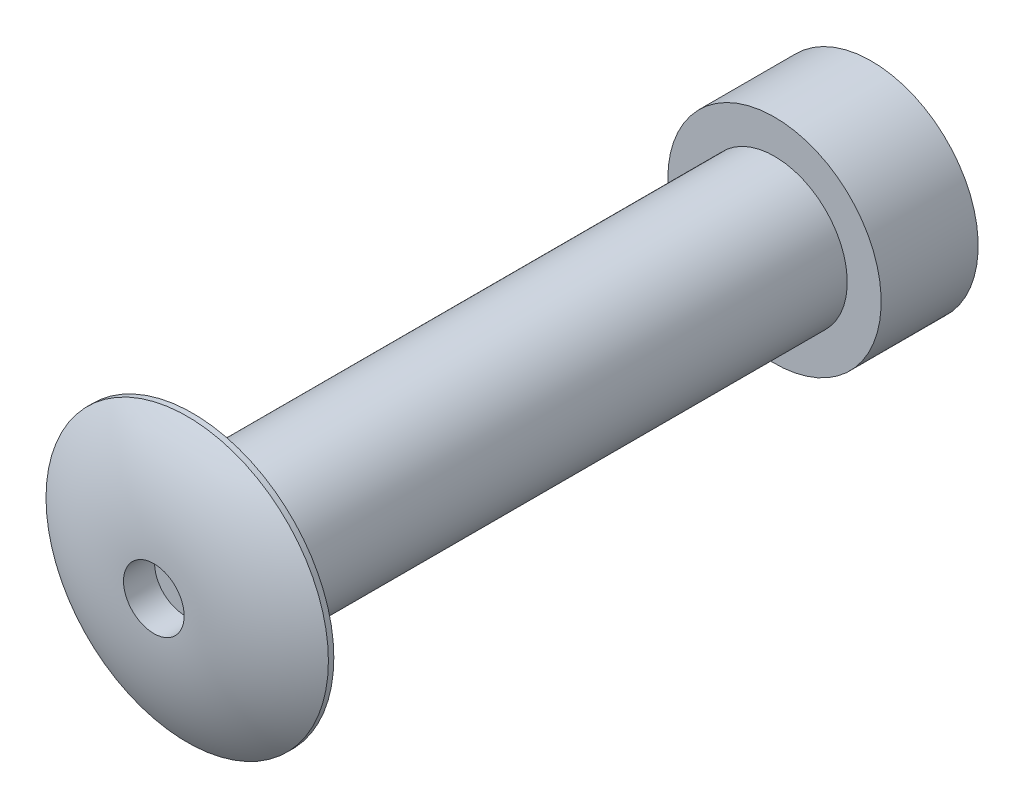
from build123d import *

# Parameters (mm, degrees)
SKETCH4_R          = 0.9921875
CUT_EXTRUDE1_DEPTH = 1.016
CUT_EXTRUDE2_START = -2.54
SKETCH3_R          = 0.9921875
CUT_EXTRUDE2_DEPTH = 2.54


with BuildPart() as part:
    # Sketch2 → Revolve1 (revolve)
    with BuildSketch(Plane(origin=(0, 0, 0), x_dir=(0, 0, -1), z_dir=(1, 0, 0)), mode=Mode.PRIVATE) as revolve1_sk:
        with BuildLine():
            Line((-1.27, 0.9921875), (-1.27, 0))
            Line((-1.27, 0), (19.05, 0))
            Line((19.05, 0), (22.225, 0))
            Line((22.225, 0), (22.225, 3.4925))
            Line((22.225, 3.4925), (19.05, 3.4925))
            Line((19.05, 3.4925), (19.05, 2.38125))
            Line((19.05, 2.38125), (0, 2.38125))
            Line((0, 2.38125), (0, 4.6228))
            Line((0, 4.6228), (-0.1778, 4.6228))
            ThreePointArc((-0.1778, 4.6228), (-0.991036966, 2.887856773), (-1.27, 0.9921875))
        make_face()
    revolve(revolve1_sk.sketch.rotate(Axis((0, 0, 7.600580616), (0, 0, 1)), 90), axis=Axis((0, 0, 7.600580616), (0, 0, 1)))

    # Sketch4 → Cut-Extrude1 (cut)
    with BuildSketch(Plane.XY.offset(1.27)):
        Circle(SKETCH4_R)
    extrude(amount=-CUT_EXTRUDE1_DEPTH, mode=Mode.SUBTRACT)

    # Sketch3 → Cut-Extrude2 (cut)
    with BuildSketch(Plane(origin=(0, 0, -22.225), x_dir=(-1, 0, 0), z_dir=(0, 0, -1)).offset(CUT_EXTRUDE2_START)):
        with Locations(Location((0, 0, 0), (0, 0, 180))):
            Circle(SKETCH3_R)
    extrude(amount=CUT_EXTRUDE2_DEPTH, mode=Mode.SUBTRACT)


solid = part.part
